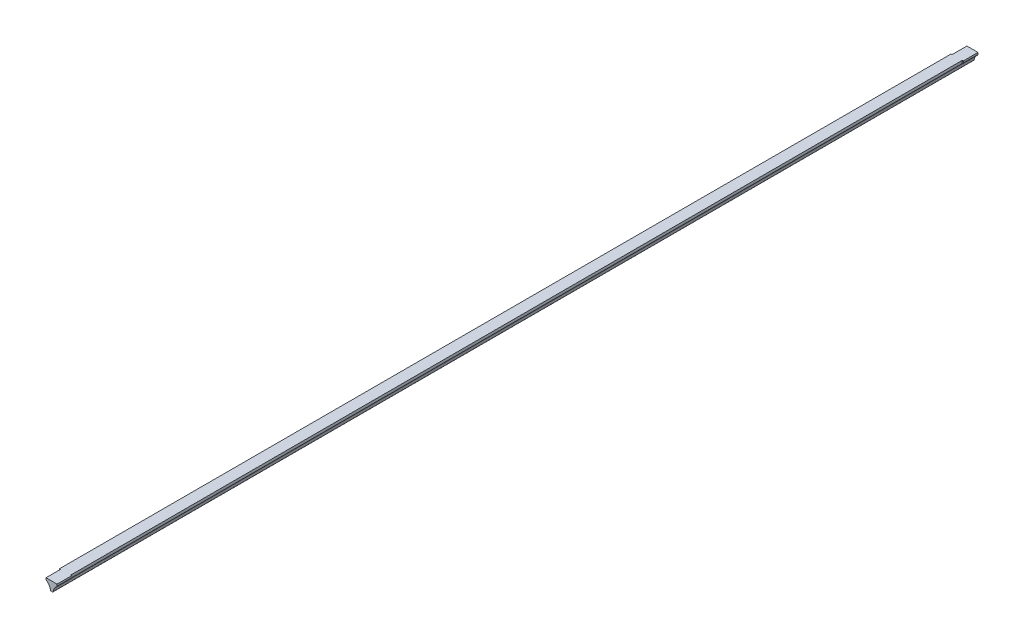
from build123d import *

# Parameters (mm, degrees)
BOSS_EXTRUDE1_DEPTH     = 250
CUT_EXTRUDE6_DEPTH      = 242
CUT_EXTRUDE6_DEPTH_BACK = 242
SKETCH9_W               = 0.558111167
SKETCH9_H               = 1.818787441
CUT_EXTRUDE7_START      = -8
SKETCH11_R              = 0.139327756
SKETCH11_R_2            = 0.125822814
CUT_EXTRUDE7_DEPTH      = 8
SKETCH13_R              = 0.125822814
CUT_EXTRUDE12_DEPTH     = 1
FILLET3_R               = 0.5


with BuildPart() as part:
    # Sketch1 → Boss-Extrude1 (new, symmetric)
    with BuildSketch(Plane.XY):
        with BuildLine():
            Line((2.869208069, 3.068545431), (-3.706559837, 3.068545431))
            Line((-3.706559837, 3.068545431), (-3.706559837, 2.312213583))
            ThreePointArc((-3.706559837, 2.312213583), (-1.749706829, 0.836593392), (-0.796044874, -1.421117289))
            ThreePointArc((-0.796044874, -1.421117289), (-0.61902671, -1.745895622), (-0.271314784, -1.872041617))
            ThreePointArc((-0.271314784, -1.872041617), (0, -1.870162722), (0.271314784, -1.872041617))
            ThreePointArc((0.271314784, -1.872041617), (0.61902671, -1.745895622), (0.796044874, -1.421117289))
            ThreePointArc((0.796044874, -1.421117289), (1.477625841, 0.448969612), (2.869208069, 1.872091721))
            Line((2.869208069, 1.872091721), (2.869208069, 3.068545431))
        make_face()
    extrude(amount=BOSS_EXTRUDE1_DEPTH, both=True)

    # Sketch9 → Cut-Extrude6 (cut, two sides: drawn at the far end of the back side and taken through both)
    with BuildSketch(Plane.XY.offset(-CUT_EXTRUDE6_DEPTH_BACK)):
        with Locations((2.590152485, 2.15915171)):
            Rectangle(SKETCH9_W, SKETCH9_H)
    extrude(amount=CUT_EXTRUDE6_DEPTH + CUT_EXTRUDE6_DEPTH_BACK, mode=Mode.SUBTRACT)

    # Sketch11 → Cut-Extrude7 (cut)
    # profile 1 of 2: a face of its own
    with BuildSketch(Plane(origin=(0, 0, 242), x_dir=(-1, 0, 0), z_dir=(0, 0, -1)).offset(CUT_EXTRUDE7_START)):
        with Locations((-2.619208069, 2.568545431)):
            Circle(SKETCH11_R)
    # profile 2 of 2: a face of its own
    with BuildSketch(Plane(origin=(0, 0, 242), x_dir=(-1, 0, 0), z_dir=(0, 0, -1)).offset(CUT_EXTRUDE7_START)):
        with BuildLine():
            Line((3.706559837, 3.068545431), (3.706559837, 2.312213583))
            ThreePointArc((3.706559837, 2.312213583), (3.423086279, 2.186837068), (3.14844867, 2.043133511))
            Line((3.14844867, 2.043133511), (3.14844867, 3.068545431))
            Line((3.14844867, 3.068545431), (3.706559837, 3.068545431))
        make_face()
        with Locations((3.438785788, 2.465008687)):
            Circle(SKETCH11_R_2, mode=Mode.SUBTRACT)
    cut_extrude7 = extrude(amount=CUT_EXTRUDE7_DEPTH, mode=Mode.SUBTRACT)

    # Sketch13 → Cut-Extrude12 (cut)
    with BuildSketch(Plane.XY.offset(250)):
        with Locations(Location((-3.438785788, 2.465008687, 0), (0, 0, 180))):
            Circle(SKETCH13_R)
    cut_extrude12 = extrude(amount=-CUT_EXTRUDE12_DEPTH, mode=Mode.SUBTRACT)

    # Mirror1: Cut-Extrude7, Cut-Extrude12 across plane
    add(cut_extrude7.mirror(Plane.XY), mode=Mode.SUBTRACT)
    add(cut_extrude12.mirror(Plane.XY), mode=Mode.SUBTRACT)

    # Fillet3
    fillet3_edges = [part.edges().sort_by_distance(p)[0] for p in [
        (-3.14844867, 2.043133511, -246),
        (2.869208069, 1.872091721, 246),
        (2.869208069, 1.872091721, -246),
        (2.311096902, 1.439762425, 0),
        (-3.706559837, 2.312213583, 0),
        (-3.14844867, 2.043133511, 246),
    ]]
    fillet(fillet3_edges, radius=FILLET3_R)


solid = part.part
